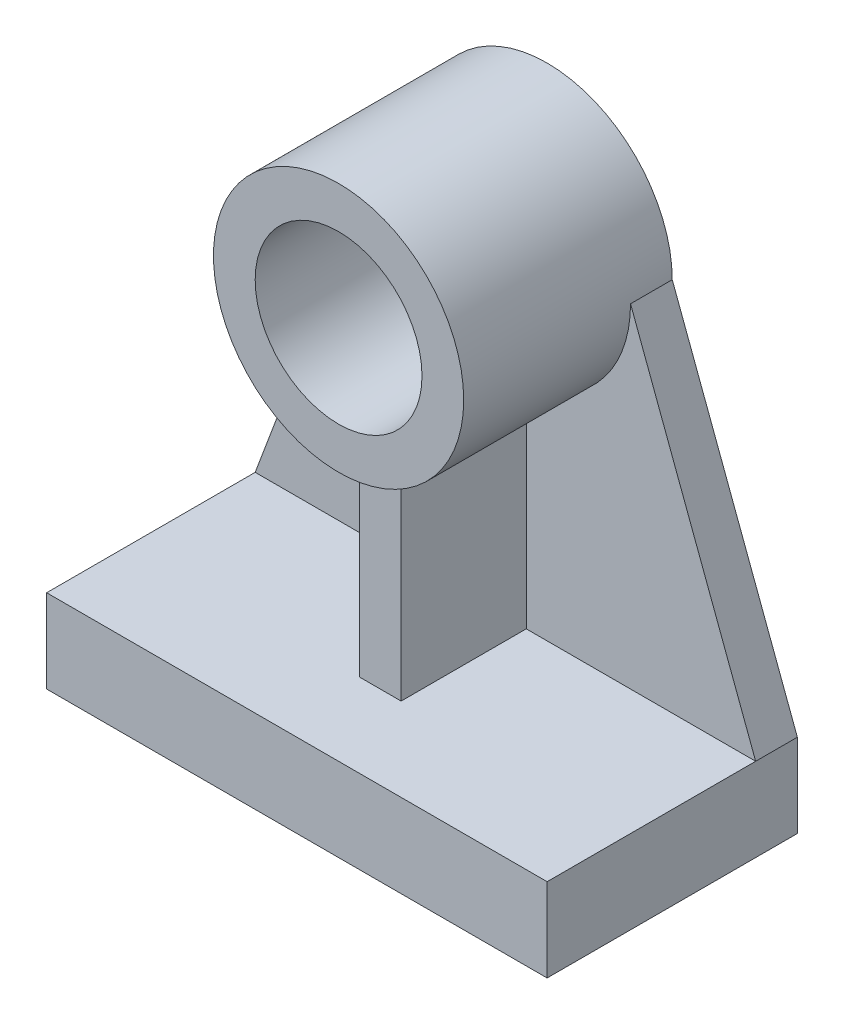
from build123d import *

# Parameters (mm, degrees)
SKETCH2_R            = 50.8
BOSS_EXTRUDE7_DEPTH  = 127
BOSS_EXTRUDE8_DEPTH  = 101.6
BOSS_EXTRUDE9_DEPTH  = 152.4
BOSS_EXTRUDE10_DEPTH = 25.4


with BuildPart() as part:
    # Sketch2 → Boss-Extrude7 (new body)
    with BuildSketch(Plane.XY):
        with BuildLine():
            ThreePointArc((76.2, 0), (0, 76.2), (-76.2, 0))
            ThreePointArc((-76.2, 0), (-58.198711326, -49.186888497), (-12.7, -75.134213245))
            ThreePointArc((-12.7, -75.134213245), (0, -76.2), (12.7, -75.134213245))
            ThreePointArc((12.7, -75.134213245), (58.198711326, -49.186888497), (76.2, 0))
        make_face()
        Circle(SKETCH2_R, mode=Mode.SUBTRACT)
    extrude(amount=BOSS_EXTRUDE7_DEPTH)

    # Sketch2<11> → Boss-Extrude8 (add)
    with BuildSketch(Plane.XY):
        with BuildLine():
            ThreePointArc((12.7, -75.134213245), (0, -76.2), (-12.7, -75.134213245))
            Line((-12.7, -75.134213245), (-12.7, -203.2))
            Line((-12.7, -203.2), (12.7, -203.2))
            Line((12.7, -203.2), (12.7, -75.134213245))
        make_face()
    extrude(amount=BOSS_EXTRUDE8_DEPTH)

    # Sketch2<12> → Boss-Extrude9 (add)
    with BuildSketch(Plane.XY):
        Polygon((-12.7, -203.2), (-152.4, -203.2), (-152.4, -254), (152.4, -254), (152.4, -203.2), (12.7, -203.2), align=None)
    extrude(amount=BOSS_EXTRUDE9_DEPTH)

    # Sketch2<13> → Boss-Extrude10 (add)
    with BuildSketch(Plane.XY):
        with BuildLine():
            ThreePointArc((-12.7, -75.134213245), (-58.198711326, -49.186888497), (-76.2, 0))
            Line((-76.2, 0), (-152.4, -203.2))
            Line((-152.4, -203.2), (-12.7, -203.2))
            Line((-12.7, -203.2), (-12.7, -75.134213245))
        make_face()
        with BuildLine():
            Line((152.4, -203.2), (76.2, 0))
            ThreePointArc((76.2, 0), (58.198711326, -49.186888497), (12.7, -75.134213245))
            Line((12.7, -75.134213245), (12.7, -203.2))
            Line((12.7, -203.2), (152.4, -203.2))
        make_face()
    extrude(amount=BOSS_EXTRUDE10_DEPTH)


solid = part.part
